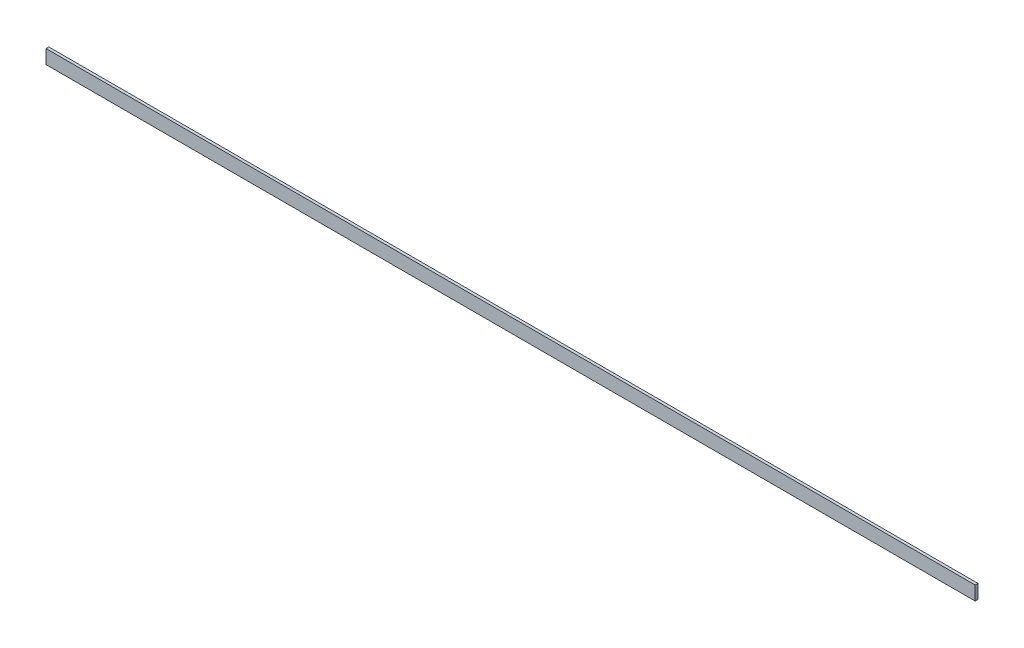
from build123d import *

# Parameters (mm, degrees)
SKETCH1_W           = 1000
SKETCH1_H           = 15
BOSS_EXTRUDE1_DEPTH = 3


with BuildPart() as part:
    # Sketch1 → Boss-Extrude1 (new body)
    with BuildSketch(Plane.XY):
        with Locations((500, 7.5)):
            Rectangle(SKETCH1_W, SKETCH1_H)
    extrude(amount=BOSS_EXTRUDE1_DEPTH)


solid = part.part
